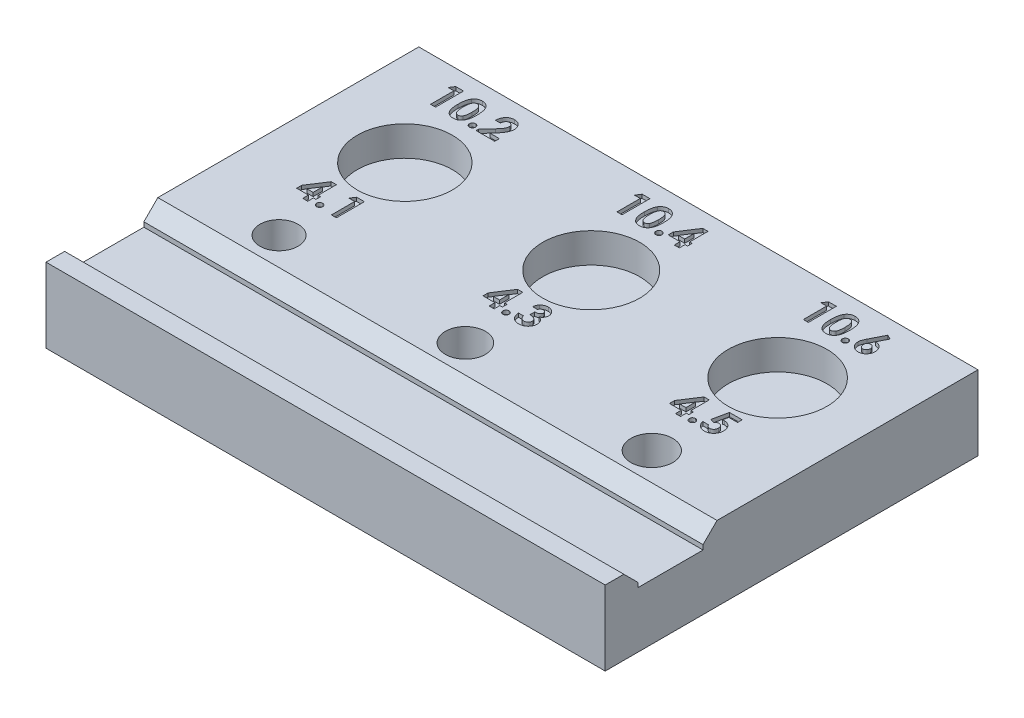
from build123d import *

# Parameters (mm, degrees)
CROQUIS1_W              = 60
CROQUIS1_H              = 40
SALIENTE_EXTRUIR1_DEPTH = 8
CROQUIS2_R              = 5.1
CORTAR_EXTRUIR1_DEPTH   = 3.2
CROQUIS3_R              = 5.2
CORTAR_EXTRUIR2_DEPTH   = 3.2
CROQUIS4_R              = 5.3
CORTAR_EXTRUIR3_DEPTH   = 3.2
CROQUIS5_R              = 2.05
CORTAR_EXTRUIR4_DEPTH   = 4.3
CROQUIS6_R              = 2.15
CORTAR_EXTRUIR5_DEPTH   = 4.3
CROQUIS7_R              = 2.25
CORTAR_EXTRUIR6_DEPTH   = 4.3
CROQUIS8_W              = 60
CROQUIS8_H              = 7
CORTAR_EXTRUIR7_DEPTH   = 2
CHAFL_N1_SIZE           = 1.5
CORTAR_EXTRUIR8_DEPTH   = 0.4


with BuildPart() as part:
    # Croquis1 → Saliente-Extruir1 (new body)
    with BuildSketch(Plane(origin=(0, 0, 0), x_dir=(1, 0, 0), z_dir=(0, 1, 0))):
        Rectangle(CROQUIS1_W, CROQUIS1_H)
    extrude(amount=-SALIENTE_EXTRUIR1_DEPTH)

    # Croquis2 → Cortar-Extruir1 (cut)
    with BuildSketch(Plane(origin=(0, 0, 0), x_dir=(1, 0, 0), z_dir=(0, 1, 0))):
        with Locations(Location((-20, 8.5, 0), (0, 0, 270))):
            Circle(CROQUIS2_R)
    extrude(amount=-CORTAR_EXTRUIR1_DEPTH, mode=Mode.SUBTRACT)

    # Croquis3 → Cortar-Extruir2 (cut)
    with BuildSketch(Plane(origin=(0, 0, 0), x_dir=(1, 0, 0), z_dir=(0, 1, 0))):
        with Locations(Location((0, 8.5, 0), (0, 0, 270))):
            Circle(CROQUIS3_R)
    extrude(amount=-CORTAR_EXTRUIR2_DEPTH, mode=Mode.SUBTRACT)

    # Croquis4 → Cortar-Extruir3 (cut)
    with BuildSketch(Plane(origin=(0, 0, 0), x_dir=(1, 0, 0), z_dir=(0, 1, 0))):
        with Locations(Location((20, 8.5, 0), (0, 0, 270))):
            Circle(CROQUIS4_R)
    extrude(amount=-CORTAR_EXTRUIR3_DEPTH, mode=Mode.SUBTRACT)

    # Croquis5 → Cortar-Extruir4 (cut)
    with BuildSketch(Plane(origin=(0, 0, 0), x_dir=(1, 0, 0), z_dir=(0, 1, 0))):
        with Locations(Location((-20, -5, 0), (0, 0, 270))):
            Circle(CROQUIS5_R)
    extrude(amount=-CORTAR_EXTRUIR4_DEPTH, mode=Mode.SUBTRACT)

    # Croquis6 → Cortar-Extruir5 (cut)
    with BuildSketch(Plane(origin=(0, 0, 0), x_dir=(1, 0, 0), z_dir=(0, 1, 0))):
        with Locations(Location((0, -5, 0), (0, 0, 270))):
            Circle(CROQUIS6_R)
    extrude(amount=-CORTAR_EXTRUIR5_DEPTH, mode=Mode.SUBTRACT)

    # Croquis7 → Cortar-Extruir6 (cut)
    with BuildSketch(Plane(origin=(0, 0, 0), x_dir=(1, 0, 0), z_dir=(0, 1, 0))):
        with Locations(Location((20, -5, 0), (0, 0, 270))):
            Circle(CROQUIS7_R)
    extrude(amount=-CORTAR_EXTRUIR6_DEPTH, mode=Mode.SUBTRACT)

    # Croquis8 → Cortar-Extruir7 (cut)
    with BuildSketch(Plane(origin=(0, 0, 0), x_dir=(1, 0, 0), z_dir=(0, 1, 0))):
        with Locations((0, -13)):
            Rectangle(CROQUIS8_W, CROQUIS8_H)
    extrude(amount=-CORTAR_EXTRUIR7_DEPTH, mode=Mode.SUBTRACT)

    # Chaflán1
    chafl_n1_edges = [part.edges().sort_by_distance(p)[0] for p in [
        (0, 0, 16.5),
        (0, 0, 9.5),
    ]]
    chamfer(chafl_n1_edges, length=CHAFL_N1_SIZE)

    # Croquis9 → Cortar-Extruir8 (cut)
    # profile 1 of 21: a face of its own
    with BuildSketch(Plane(origin=(0, 0, 0), x_dir=(1, 0, 0), z_dir=(0, 1, 0))):
        Polygon((-24.332331731, 18.3), (-23.5, 18.3), (-23.5, 15.3), (-24.038461538, 15.3), (-24.038461538, 17.8), (-24.653846154, 17.8), align=None)
    # profile 2 of 21: a face of its own
    with BuildSketch(Plane(origin=(0, 0, 0), x_dir=(1, 0, 0), z_dir=(0, 1, 0))):
        with BuildLine():
            add(Edge.make_bspline(
                [(-21.566706731, 18.376923077), (-21.540642957, 18.376536153), (-21.489394615, 18.375775357), (-21.413915454, 18.367535315), (-21.341208153, 18.355086911), (-21.270988273, 18.337725728), (-21.203761262, 18.314748821), (-21.13903783, 18.287245856), (-21.077588371, 18.253774248), (-21.01862921, 18.215966347), (-20.962183058, 18.173162443), (-20.909606557, 18.124363783), (-20.85993955, 18.070693226), (-20.814257145, 18.011339368), (-20.77154769, 17.946842097), (-20.731951521, 17.877191185), (-20.695771758, 17.802045738), (-20.662602911, 17.721270149), (-20.632943224, 17.633653628), (-20.607960906, 17.538191174), (-20.586534388, 17.434860988), (-20.568448895, 17.323405865), (-20.554779185, 17.203677655), (-20.545565525, 17.075755898), (-20.539242676, 16.939887209), (-20.538726649, 16.846682405), (-20.538461538, 16.798798077)],
                knots=[0, 0, 0, 0, 0.879237366, 1.728815576, 2.559023295, 3.367336655, 4.166867292, 4.954216142, 5.737608147, 6.525189134, 7.316157332, 8.124696809, 8.942788509, 9.781158001, 10.649253743, 11.551476218, 12.482711956, 13.461909668, 14.496590415, 15.601789533, 16.789733467, 18.056700938, 19.410929216, 20.8549011, 22.384193279, 24, 24, 24, 24], degree=3))
            add(Edge.make_bspline(
                [(-20.538461538, 16.798798077), (-20.538748052, 16.750314662), (-20.539304742, 16.656112256), (-20.545302683, 16.519000843), (-20.555631421, 16.390150298), (-20.568943844, 16.26957395), (-20.587178222, 16.157335474), (-20.608533214, 16.053144248), (-20.63390987, 15.957038038), (-20.664546539, 15.869233393), (-20.697514614, 15.788315944), (-20.733793344, 15.713317013), (-20.772750397, 15.644033459), (-20.813492214, 15.579420047), (-20.858252412, 15.521381547), (-20.904852387, 15.467944346), (-20.955321183, 15.421143937), (-21.00753387, 15.378568436), (-21.06340321, 15.341774659), (-21.122353036, 15.309595428), (-21.185434323, 15.283494249), (-21.251497205, 15.260792839), (-21.321667737, 15.244495675), (-21.394830919, 15.231564412), (-21.47181275, 15.224417802), (-21.52422508, 15.223531218), (-21.551081731, 15.223076923)],
                knots=[0, 0, 0, 0, 1.643780988, 3.193836972, 4.651895693, 6.025988579, 7.305620092, 8.505800249, 9.631074763, 10.672816429, 11.65661981, 12.592235626, 13.49536222, 14.350718032, 15.179365177, 15.97804903, 16.751647189, 17.51006938, 18.259804725, 19.016521909, 19.783502495, 20.571750527, 21.382245291, 22.22305063, 23.089471752, 24, 24, 24, 24], degree=3))
            add(Edge.make_bspline(
                [(-21.551081731, 15.223076923), (-21.577937656, 15.223539981), (-21.630548019, 15.224447106), (-21.707738016, 15.231511274), (-21.781288927, 15.24454806), (-21.85201462, 15.260917956), (-21.919422858, 15.28344402), (-21.983836859, 15.310326127), (-22.044761336, 15.342304576), (-22.10236498, 15.379184079), (-22.156451115, 15.421474718), (-22.207860239, 15.468724147), (-22.256478633, 15.520812601), (-22.301566689, 15.578323513), (-22.343862821, 15.640489233), (-22.382925945, 15.708019664), (-22.418732587, 15.780816481), (-22.452402784, 15.858981158), (-22.481657924, 15.944196489), (-22.50769364, 16.037223436), (-22.529021413, 16.138837457), (-22.546174636, 16.249005906), (-22.559869759, 16.367495387), (-22.570057357, 16.494363091), (-22.576088614, 16.62966811), (-22.576639466, 16.72266999), (-22.576923077, 16.770552885)],
                knots=[0, 0, 0, 0, 0.917216111, 1.796812873, 2.643793957, 3.46689424, 4.273913431, 5.068098542, 5.848489301, 6.620921603, 7.401012384, 8.190319798, 9.003608147, 9.831726257, 10.68377682, 11.569763213, 12.493818149, 13.453288342, 14.474581811, 15.568529029, 16.750744269, 18.018426408, 19.375425659, 20.823733699, 22.36466933, 24, 24, 24, 24], degree=3))
            add(Edge.make_bspline(
                [(-22.576923077, 16.770552885), (-22.576409342, 16.837082398), (-22.575418083, 16.96545195), (-22.562856122, 17.15090863), (-22.544418351, 17.322331205), (-22.517337632, 17.479432927), (-22.483852697, 17.622795656), (-22.440973495, 17.751474991), (-22.392158643, 17.867251502), (-22.350562117, 17.935838203), (-22.330528846, 17.968870192)],
                knots=[0, 0, 0, 0, 1.288568992, 2.486310467, 3.599230591, 4.627010532, 5.572937695, 6.447898582, 7.252493626, 8, 8, 8, 8], degree=3))
            add(Edge.make_bspline(
                [(-22.330528846, 17.968870192), (-22.307235113, 18.001320808), (-22.261691275, 18.064768156), (-22.182056601, 18.148062663), (-22.096499512, 18.219300205), (-22.003262714, 18.276868612), (-21.903820786, 18.322267062), (-21.797319969, 18.354331475), (-21.684153552, 18.373013697), (-21.606440285, 18.375600491), (-21.566706731, 18.376923077)],
                knots=[0, 0, 0, 0, 1.058512271, 2.069600068, 3.047294572, 4.004278952, 4.967380941, 5.939006123, 6.946246673, 8, 8, 8, 8], degree=3))
        make_face()
        with BuildLine():
            add(Edge.make_bspline(
                [(-21.553485577, 17.838461538), (-21.577047444, 17.837344753), (-21.623241211, 17.83515526), (-21.690270568, 17.816569556), (-21.753475067, 17.787862934), (-21.801553041, 17.753319002), (-21.837538927, 17.720204501), (-21.862682523, 17.690236955), (-21.886929558, 17.656795333), (-21.908345761, 17.618370587), (-21.928568247, 17.576343363), (-21.948331711, 17.530522884), (-21.964532562, 17.479783698), (-21.980449469, 17.424989901), (-21.994394165, 17.364626591), (-22.006076762, 17.298200362), (-22.016514137, 17.22527924), (-22.023794329, 17.145815462), (-22.030581654, 17.059892165), (-22.03544713, 16.967317946), (-22.037481263, 16.86811778), (-22.038127852, 16.799800098), (-22.038461538, 16.764543269)],
                knots=[0, 0, 0, 0, 1.076674018, 2.110852608, 3.161083442, 4.239746716, 4.804137807, 5.395870207, 6.026861976, 6.692161227, 7.405688833, 8.16177676, 8.973626916, 9.841385931, 10.773283133, 11.807421078, 12.927755683, 14.143907515, 15.458935494, 16.872852025, 18.386167141, 20, 20, 20, 20], degree=3))
            add(Edge.make_bspline(
                [(-22.038461538, 16.764543269), (-22.037912331, 16.718866343), (-22.036859185, 16.631277451), (-22.0313433, 16.505321574), (-22.020287167, 16.390691584), (-22.006535569, 16.286610591), (-21.987220888, 16.193753587), (-21.964998097, 16.11124206), (-21.937554927, 16.040127831), (-21.905839055, 15.979382429), (-21.870712299, 15.927706441), (-21.832580659, 15.883781619), (-21.792742382, 15.845744795), (-21.749953986, 15.814847952), (-21.704317551, 15.791170035), (-21.656214057, 15.774138803), (-21.605612935, 15.763713276), (-21.570961809, 15.76226759), (-21.553485577, 15.761538462)],
                knots=[0, 0, 0, 0, 1.771748488, 3.397459088, 4.888034009, 6.237357457, 7.467047327, 8.564189669, 9.548206622, 10.417051504, 11.216568818, 11.965764335, 12.669334354, 13.348544111, 14.005342236, 14.656555988, 15.322436492, 16, 16, 16, 16], degree=3))
            add(Edge.make_bspline(
                [(-21.553485577, 15.761538462), (-21.536609074, 15.762037386), (-21.50356698, 15.763014217), (-21.455384207, 15.773041259), (-21.409819152, 15.789343052), (-21.367009393, 15.812403082), (-21.326801802, 15.841727438), (-21.289392892, 15.877444985), (-21.255064791, 15.919911742), (-21.235065084, 15.951428357), (-21.224759615, 15.967668269)],
                knots=[0, 0, 0, 0, 0.992283464, 1.942767638, 2.88273346, 3.832339453, 4.79467288, 5.803907806, 6.868395428, 8, 8, 8, 8], degree=3))
            add(Edge.make_bspline(
                [(-21.224759615, 15.967668269), (-21.212626661, 15.989859591), (-21.18718484, 16.036392992), (-21.157743521, 16.114916372), (-21.13296146, 16.203477767), (-21.111631902, 16.302352787), (-21.097043786, 16.411931409), (-21.084480518, 16.531518784), (-21.078420941, 16.661717107), (-21.077435318, 16.751918975), (-21.076923077, 16.798798077)],
                knots=[0, 0, 0, 0, 0.710965849, 1.490837728, 2.352621235, 3.297892224, 4.334225155, 5.461620853, 6.680770821, 8, 8, 8, 8], degree=3))
            add(Edge.make_bspline(
                [(-21.076923077, 16.798798077), (-21.077120945, 16.846084113), (-21.077501806, 16.937101659), (-21.084489515, 17.067768054), (-21.094220434, 17.18711012), (-21.108453958, 17.294861414), (-21.126767974, 17.391283509), (-21.149340069, 17.476370104), (-21.175950889, 17.550288885), (-21.20750815, 17.612966147), (-21.242459778, 17.666233222), (-21.279561997, 17.71193224), (-21.318971692, 17.750948909), (-21.360622957, 17.783430055), (-21.405479824, 17.808248087), (-21.452685469, 17.82577167), (-21.502336667, 17.836372851), (-21.536205813, 17.837755912), (-21.553485577, 17.838461538)],
                knots=[0, 0, 0, 0, 1.793836731, 3.452829483, 4.963243077, 6.335886805, 7.574563692, 8.684454726, 9.672768357, 10.54971625, 11.340229787, 12.085688095, 12.778991901, 13.440269426, 14.083255152, 14.715733572, 15.344777694, 16, 16, 16, 16], degree=3))
        make_face(mode=Mode.SUBTRACT)
    # profile 3 of 21: a face of its own
    with BuildSketch(Plane(origin=(0, 0, 0), x_dir=(1, 0, 0), z_dir=(0, 1, 0))):
        with BuildLine():
            add(Edge.make_bspline(
                [(-19.826923077, 15.915384615), (-19.805186023, 15.914192825), (-19.762389518, 15.911846395), (-19.700554404, 15.894335237), (-19.644747857, 15.862873947), (-19.594849348, 15.821838146), (-19.552656425, 15.772466599), (-19.522160334, 15.716164386), (-19.503169653, 15.654567531), (-19.501073069, 15.611636383), (-19.5, 15.589663462)],
                knots=[0, 0, 0, 0, 1.016957001, 2.002212695, 2.9757545, 3.99499976, 5.013036768, 5.994806404, 6.97370641, 8, 8, 8, 8], degree=3))
            add(Edge.make_bspline(
                [(-19.5, 15.589663462), (-19.501066039, 15.567687011), (-19.503148889, 15.524748968), (-19.522291748, 15.463032087), (-19.552610854, 15.406267121), (-19.594852733, 15.356366526), (-19.64454121, 15.314557367), (-19.700682713, 15.283386196), (-19.762271723, 15.264881674), (-19.80516529, 15.262663587), (-19.826923077, 15.261538462)],
                knots=[0, 0, 0, 0, 1.023218912, 1.999186227, 2.986238111, 4.008388923, 5.030539734, 6.0011649, 6.986089706, 8, 8, 8, 8], degree=3))
            add(Edge.make_bspline(
                [(-19.826923077, 15.261538462), (-19.848686019, 15.262654438), (-19.891589749, 15.264854488), (-19.953274496, 15.283542171), (-20.009830479, 15.314349256), (-20.059531441, 15.35641724), (-20.101962038, 15.406090419), (-20.131419143, 15.463211191), (-20.150740312, 15.5247257), (-20.152794688, 15.567679134), (-20.153846154, 15.589663462)],
                knots=[0, 0, 0, 0, 1.013427518, 1.99788335, 2.976245624, 3.997909735, 5.019573847, 6.001765691, 6.977268297, 8, 8, 8, 8], degree=3))
            add(Edge.make_bspline(
                [(-20.153846154, 15.589663462), (-20.152787751, 15.611644398), (-20.150719822, 15.654591204), (-20.131550183, 15.71598322), (-20.101914827, 15.772644262), (-20.059534979, 15.821787326), (-20.009622767, 15.863080433), (-19.953403525, 15.894181399), (-19.891472014, 15.911873782), (-19.848665311, 15.91420205), (-19.826923077, 15.915384615)],
                knots=[0, 0, 0, 0, 1.025808215, 2.00424526, 2.981110158, 3.998665696, 5.017428914, 5.998734231, 6.983523959, 8, 8, 8, 8], degree=3))
        make_face()
    # profile 4 of 21: a face of its own
    with BuildSketch(Plane(origin=(0, 0, 0), x_dir=(1, 0, 0), z_dir=(0, 1, 0))):
        with BuildLine():
            Line((-18.538461538, 17.3), (-19.076923077, 17.3))
            add(Edge.make_bspline(
                [(-19.076923077, 17.3), (-19.074597544, 17.340731767), (-19.070053593, 17.420319193), (-19.051978902, 17.535922479), (-19.027759437, 17.645154871), (-18.995435346, 17.747634264), (-18.954818011, 17.843323419), (-18.906952619, 17.932548547), (-18.85061632, 18.014839874), (-18.787008135, 18.089800546), (-18.717207957, 18.157048456), (-18.642664904, 18.216674678), (-18.562238741, 18.265876736), (-18.47739892, 18.306365474), (-18.388159887, 18.338714095), (-18.293677301, 18.360341766), (-18.194769242, 18.374988236), (-18.127058667, 18.376269861), (-18.092548077, 18.376923077)],
                knots=[0, 0, 0, 0, 1.199038563, 2.342849363, 3.436047546, 4.486744587, 5.497670872, 6.488682221, 7.459191391, 8.424610317, 9.374430501, 10.305433194, 11.225809216, 12.140057399, 13.06607119, 14.010487599, 14.985989317, 16, 16, 16, 16], degree=3))
            add(Edge.make_bspline(
                [(-18.092548077, 18.376923077), (-18.050186817, 18.375601294), (-17.967487711, 18.373020864), (-17.847319351, 18.351008939), (-17.735095241, 18.314190592), (-17.630896958, 18.262745652), (-17.53561156, 18.197390248), (-17.449254848, 18.119464625), (-17.374438388, 18.027333863), (-17.31068782, 17.924831372), (-17.257718717, 17.81629566), (-17.220600176, 17.704065233), (-17.196202558, 17.591118232), (-17.193600401, 17.515065438), (-17.192307692, 17.477283654)],
                knots=[0, 0, 0, 0, 1.075374347, 2.099382735, 3.09057751, 4.06680945, 5.040638231, 6.016817125, 7.011024321, 8.044445721, 9.0776792, 10.070479129, 11.0414456, 12, 12, 12, 12], degree=3))
            add(Edge.make_bspline(
                [(-17.192307692, 17.477283654), (-17.192811005, 17.454430561), (-17.193824049, 17.408432929), (-17.200867878, 17.338827224), (-17.211435014, 17.267925674), (-17.227367679, 17.195789073), (-17.247237019, 17.122397199), (-17.2713414, 17.047530415), (-17.300239948, 16.971613188), (-17.333450403, 16.893791084), (-17.373070561, 16.813811444), (-17.419202727, 16.730475342), (-17.473071354, 16.643856704), (-17.534025777, 16.553466453), (-17.602362037, 16.459447149), (-17.678413729, 16.362082006), (-17.761304916, 16.261027941), (-17.820135123, 16.19347897), (-17.850360577, 16.158774038)],
                knots=[0, 0, 0, 0, 0.728284026, 1.46585585, 2.227944881, 3.01186502, 3.81876927, 4.650621989, 5.517437689, 6.406905708, 7.346299482, 8.360816762, 9.441613733, 10.596154504, 11.834900912, 13.145207542, 14.533280747, 16, 16, 16, 16], degree=3))
            Line((-17.850360577, 16.158774038), (-18.163461538, 15.8))
            Line((-18.163461538, 15.8), (-17.153846154, 15.8))
            Line((-17.153846154, 15.8), (-17.153846154, 15.3))
            Line((-17.153846154, 15.3), (-19.153846154, 15.3))
            Line((-19.153846154, 15.3), (-19.153846154, 15.572836538))
            Line((-19.153846154, 15.572836538), (-18.265625, 16.518149038))
            add(Edge.make_bspline(
                [(-18.265625, 16.518149038), (-18.239908715, 16.545724098), (-18.190103897, 16.59912881), (-18.119236775, 16.677559311), (-18.055108288, 16.751987985), (-17.999048195, 16.823207346), (-17.948114534, 16.888907328), (-17.904578432, 16.951068211), (-17.868041568, 17.009128039), (-17.82837562, 17.07913805), (-17.790706009, 17.162637447), (-17.756141861, 17.258832176), (-17.73507262, 17.350772183), (-17.732164399, 17.410682268), (-17.730769231, 17.439423077)],
                knots=[0, 0, 0, 0, 1.246127091, 2.413378631, 3.493388633, 4.492180848, 5.408488754, 6.240484944, 6.999099869, 7.674939598, 8.898438119, 10.020720584, 11.050475521, 12, 12, 12, 12], degree=3))
            add(Edge.make_bspline(
                [(-17.730769231, 17.439423077), (-17.731812364, 17.467227592), (-17.733833603, 17.521103299), (-17.756045374, 17.597741205), (-17.790456621, 17.667129005), (-17.838946927, 17.727193315), (-17.897683875, 17.77655214), (-17.965559936, 17.813263848), (-18.04202172, 17.834446336), (-18.095622887, 17.837097626), (-18.123197115, 17.838461538)],
                knots=[0, 0, 0, 0, 1.062038974, 2.057870785, 3.028805853, 4.01125022, 4.991535629, 5.949134679, 6.94496649, 8, 8, 8, 8], degree=3))
            add(Edge.make_bspline(
                [(-18.123197115, 17.838461538), (-18.137442313, 17.837957693), (-18.165486272, 17.836965792), (-18.206708699, 17.830362976), (-18.2459348, 17.818726203), (-18.283601184, 17.803134564), (-18.319305864, 17.782467735), (-18.352958782, 17.756992576), (-18.384914514, 17.727356468), (-18.415026499, 17.693652079), (-18.442432336, 17.656037972), (-18.466774101, 17.614857673), (-18.486900688, 17.570136746), (-18.504620866, 17.522465573), (-18.518287516, 17.471332129), (-18.528238532, 17.417042441), (-18.535803625, 17.359684831), (-18.53755945, 17.320256868), (-18.538461538, 17.3)],
                knots=[0, 0, 0, 0, 0.903469896, 1.778625579, 2.63899355, 3.493148037, 4.358286772, 5.247621495, 6.164656832, 7.118446693, 8.109501108, 9.111810964, 10.146451449, 11.215617525, 12.33435995, 13.498009769, 14.714554818, 16, 16, 16, 16], degree=3))
        make_face()
    # profile 5 of 21: a face of its own
    with BuildSketch(Plane(origin=(0, 0, 0), x_dir=(1, 0, 0), z_dir=(0, 1, 0))):
        Polygon((-4.332331731, 18.3), (-3.5, 18.3), (-3.5, 15.3), (-4.038461538, 15.3), (-4.038461538, 17.8), (-4.653846154, 17.8), align=None)
    # profile 6 of 21: a face of its own
    with BuildSketch(Plane(origin=(0, 0, 0), x_dir=(1, 0, 0), z_dir=(0, 1, 0))):
        with BuildLine():
            add(Edge.make_bspline(
                [(-1.566706731, 18.376923077), (-1.540642957, 18.376536153), (-1.489394615, 18.375775357), (-1.413915454, 18.367535315), (-1.341208153, 18.355086911), (-1.270988273, 18.337725728), (-1.203761262, 18.314748821), (-1.13903783, 18.287245856), (-1.077588371, 18.253774248), (-1.01862921, 18.215966347), (-0.962183058, 18.173162443), (-0.909606557, 18.124363783), (-0.85993955, 18.070693226), (-0.814257145, 18.011339368), (-0.77154769, 17.946842097), (-0.731951521, 17.877191185), (-0.695771758, 17.802045738), (-0.662602911, 17.721270149), (-0.632943224, 17.633653628), (-0.607960906, 17.538191174), (-0.586534388, 17.434860988), (-0.568448895, 17.323405865), (-0.554779185, 17.203677655), (-0.545565525, 17.075755898), (-0.539242676, 16.939887209), (-0.538726649, 16.846682405), (-0.538461538, 16.798798077)],
                knots=[0, 0, 0, 0, 0.879237366, 1.728815576, 2.559023295, 3.367336655, 4.166867292, 4.954216142, 5.737608147, 6.525189134, 7.316157332, 8.124696809, 8.942788509, 9.781158001, 10.649253743, 11.551476218, 12.482711956, 13.461909668, 14.496590415, 15.601789533, 16.789733467, 18.056700938, 19.410929216, 20.8549011, 22.384193279, 24, 24, 24, 24], degree=3))
            add(Edge.make_bspline(
                [(-0.538461538, 16.798798077), (-0.538748052, 16.750314662), (-0.539304742, 16.656112256), (-0.545302683, 16.519000843), (-0.555631421, 16.390150298), (-0.568943844, 16.26957395), (-0.587178222, 16.157335474), (-0.608533214, 16.053144248), (-0.63390987, 15.957038038), (-0.664546539, 15.869233393), (-0.697514614, 15.788315944), (-0.733793344, 15.713317013), (-0.772750397, 15.644033459), (-0.813492214, 15.579420047), (-0.858252412, 15.521381547), (-0.904852387, 15.467944346), (-0.955321183, 15.421143937), (-1.00753387, 15.378568436), (-1.06340321, 15.341774659), (-1.122353036, 15.309595428), (-1.185434323, 15.283494249), (-1.251497205, 15.260792839), (-1.321667737, 15.244495675), (-1.394830919, 15.231564412), (-1.47181275, 15.224417802), (-1.52422508, 15.223531218), (-1.551081731, 15.223076923)],
                knots=[0, 0, 0, 0, 1.643780988, 3.193836972, 4.651895693, 6.025988579, 7.305620092, 8.505800249, 9.631074763, 10.672816429, 11.65661981, 12.592235626, 13.49536222, 14.350718032, 15.179365177, 15.97804903, 16.751647189, 17.51006938, 18.259804725, 19.016521909, 19.783502495, 20.571750527, 21.382245291, 22.22305063, 23.089471752, 24, 24, 24, 24], degree=3))
            add(Edge.make_bspline(
                [(-1.551081731, 15.223076923), (-1.577937656, 15.223539981), (-1.630548019, 15.224447106), (-1.707738016, 15.231511274), (-1.781288927, 15.24454806), (-1.85201462, 15.260917956), (-1.919422858, 15.28344402), (-1.983836859, 15.310326127), (-2.044761336, 15.342304576), (-2.10236498, 15.379184079), (-2.156451115, 15.421474718), (-2.207860239, 15.468724147), (-2.256478633, 15.520812601), (-2.301566689, 15.578323513), (-2.343862821, 15.640489233), (-2.382925945, 15.708019664), (-2.418732587, 15.780816481), (-2.452402784, 15.858981158), (-2.481657924, 15.944196489), (-2.50769364, 16.037223436), (-2.529021413, 16.138837457), (-2.546174636, 16.249005906), (-2.559869759, 16.367495387), (-2.570057357, 16.494363091), (-2.576088614, 16.62966811), (-2.576639466, 16.72266999), (-2.576923077, 16.770552885)],
                knots=[0, 0, 0, 0, 0.917216111, 1.796812873, 2.643793957, 3.46689424, 4.273913431, 5.068098542, 5.848489301, 6.620921603, 7.401012384, 8.190319798, 9.003608147, 9.831726257, 10.68377682, 11.569763213, 12.493818149, 13.453288342, 14.474581811, 15.568529029, 16.750744269, 18.018426408, 19.375425659, 20.823733699, 22.36466933, 24, 24, 24, 24], degree=3))
            add(Edge.make_bspline(
                [(-2.576923077, 16.770552885), (-2.576409342, 16.837082398), (-2.575418083, 16.96545195), (-2.562856122, 17.15090863), (-2.544418351, 17.322331205), (-2.517337632, 17.479432927), (-2.483852697, 17.622795656), (-2.440973495, 17.751474991), (-2.392158643, 17.867251502), (-2.350562117, 17.935838203), (-2.330528846, 17.968870192)],
                knots=[0, 0, 0, 0, 1.288568992, 2.486310467, 3.599230591, 4.627010532, 5.572937695, 6.447898582, 7.252493626, 8, 8, 8, 8], degree=3))
            add(Edge.make_bspline(
                [(-2.330528846, 17.968870192), (-2.307235113, 18.001320808), (-2.261691275, 18.064768156), (-2.182056601, 18.148062663), (-2.096499512, 18.219300205), (-2.003262714, 18.276868612), (-1.903820786, 18.322267062), (-1.797319969, 18.354331475), (-1.684153552, 18.373013697), (-1.606440285, 18.375600491), (-1.566706731, 18.376923077)],
                knots=[0, 0, 0, 0, 1.058512271, 2.069600068, 3.047294572, 4.004278952, 4.967380941, 5.939006123, 6.946246673, 8, 8, 8, 8], degree=3))
        make_face()
        with BuildLine():
            add(Edge.make_bspline(
                [(-1.553485577, 17.838461538), (-1.577047444, 17.837344753), (-1.623241211, 17.83515526), (-1.690270568, 17.816569556), (-1.753475067, 17.787862934), (-1.801553041, 17.753319002), (-1.837538927, 17.720204501), (-1.862682523, 17.690236955), (-1.886929558, 17.656795333), (-1.908345761, 17.618370587), (-1.928568247, 17.576343363), (-1.948331711, 17.530522884), (-1.964532562, 17.479783698), (-1.980449469, 17.424989901), (-1.994394165, 17.364626591), (-2.006076762, 17.298200362), (-2.016514137, 17.22527924), (-2.023794329, 17.145815462), (-2.030581654, 17.059892165), (-2.03544713, 16.967317946), (-2.037481263, 16.86811778), (-2.038127852, 16.799800098), (-2.038461538, 16.764543269)],
                knots=[0, 0, 0, 0, 1.076674018, 2.110852608, 3.161083442, 4.239746716, 4.804137807, 5.395870207, 6.026861976, 6.692161227, 7.405688833, 8.16177676, 8.973626916, 9.841385931, 10.773283133, 11.807421078, 12.927755683, 14.143907515, 15.458935494, 16.872852025, 18.386167141, 20, 20, 20, 20], degree=3))
            add(Edge.make_bspline(
                [(-2.038461538, 16.764543269), (-2.037912331, 16.718866343), (-2.036859185, 16.631277451), (-2.0313433, 16.505321574), (-2.020287167, 16.390691584), (-2.006535569, 16.286610591), (-1.987220888, 16.193753587), (-1.964998097, 16.11124206), (-1.937554927, 16.040127831), (-1.905839055, 15.979382429), (-1.870712299, 15.927706441), (-1.832580659, 15.883781619), (-1.792742382, 15.845744795), (-1.749953986, 15.814847952), (-1.704317551, 15.791170035), (-1.656214057, 15.774138803), (-1.605612935, 15.763713276), (-1.570961809, 15.76226759), (-1.553485577, 15.761538462)],
                knots=[0, 0, 0, 0, 1.771748488, 3.397459088, 4.888034009, 6.237357457, 7.467047327, 8.564189669, 9.548206622, 10.417051504, 11.216568818, 11.965764335, 12.669334354, 13.348544111, 14.005342236, 14.656555988, 15.322436492, 16, 16, 16, 16], degree=3))
            add(Edge.make_bspline(
                [(-1.553485577, 15.761538462), (-1.536609074, 15.762037386), (-1.50356698, 15.763014217), (-1.455384207, 15.773041259), (-1.409819152, 15.789343052), (-1.367009393, 15.812403082), (-1.326801802, 15.841727438), (-1.289392892, 15.877444985), (-1.255064791, 15.919911742), (-1.235065084, 15.951428357), (-1.224759615, 15.967668269)],
                knots=[0, 0, 0, 0, 0.992283464, 1.942767638, 2.88273346, 3.832339453, 4.79467288, 5.803907806, 6.868395428, 8, 8, 8, 8], degree=3))
            add(Edge.make_bspline(
                [(-1.224759615, 15.967668269), (-1.212626661, 15.989859591), (-1.18718484, 16.036392992), (-1.157743521, 16.114916372), (-1.13296146, 16.203477767), (-1.111631902, 16.302352787), (-1.097043786, 16.411931409), (-1.084480518, 16.531518784), (-1.078420941, 16.661717107), (-1.077435318, 16.751918975), (-1.076923077, 16.798798077)],
                knots=[0, 0, 0, 0, 0.710965849, 1.490837728, 2.352621235, 3.297892224, 4.334225155, 5.461620853, 6.680770821, 8, 8, 8, 8], degree=3))
            add(Edge.make_bspline(
                [(-1.076923077, 16.798798077), (-1.077120945, 16.846084113), (-1.077501806, 16.937101659), (-1.084489515, 17.067768054), (-1.094220434, 17.18711012), (-1.108453958, 17.294861414), (-1.126767974, 17.391283509), (-1.149340069, 17.476370104), (-1.175950889, 17.550288885), (-1.20750815, 17.612966147), (-1.242459778, 17.666233222), (-1.279561997, 17.71193224), (-1.318971692, 17.750948909), (-1.360622957, 17.783430055), (-1.405479824, 17.808248087), (-1.452685469, 17.82577167), (-1.502336667, 17.836372851), (-1.536205813, 17.837755912), (-1.553485577, 17.838461538)],
                knots=[0, 0, 0, 0, 1.793836731, 3.452829483, 4.963243077, 6.335886805, 7.574563692, 8.684454726, 9.672768357, 10.54971625, 11.340229787, 12.085688095, 12.778991901, 13.440269426, 14.083255152, 14.715733572, 15.344777694, 16, 16, 16, 16], degree=3))
        make_face(mode=Mode.SUBTRACT)
    # profile 7 of 21: a face of its own
    with BuildSketch(Plane(origin=(0, 0, 0), x_dir=(1, 0, 0), z_dir=(0, 1, 0))):
        with BuildLine():
            add(Edge.make_bspline(
                [(0.173076923, 15.915384615), (0.194813977, 15.914192825), (0.237610482, 15.911846395), (0.299445596, 15.894335237), (0.355252143, 15.862873947), (0.405150652, 15.821838146), (0.447343575, 15.772466599), (0.477839666, 15.716164386), (0.496830347, 15.654567531), (0.498926931, 15.611636383), (0.5, 15.589663462)],
                knots=[0, 0, 0, 0, 1.016957001, 2.002212695, 2.9757545, 3.99499976, 5.013036768, 5.994806404, 6.97370641, 8, 8, 8, 8], degree=3))
            add(Edge.make_bspline(
                [(0.5, 15.589663462), (0.498933961, 15.567687011), (0.496851111, 15.524748968), (0.477708252, 15.463032087), (0.447389146, 15.406267121), (0.405147267, 15.356366526), (0.35545879, 15.314557367), (0.299317287, 15.283386196), (0.237728277, 15.264881674), (0.19483471, 15.262663587), (0.173076923, 15.261538462)],
                knots=[0, 0, 0, 0, 1.023218912, 1.999186227, 2.986238111, 4.008388923, 5.030539734, 6.0011649, 6.986089706, 8, 8, 8, 8], degree=3))
            add(Edge.make_bspline(
                [(0.173076923, 15.261538462), (0.151313981, 15.262654438), (0.108410251, 15.264854488), (0.046725504, 15.283542171), (-0.009830479, 15.314349256), (-0.059531441, 15.35641724), (-0.101962038, 15.406090419), (-0.131419143, 15.463211191), (-0.150740312, 15.5247257), (-0.152794688, 15.567679134), (-0.153846154, 15.589663462)],
                knots=[0, 0, 0, 0, 1.013427518, 1.99788335, 2.976245624, 3.997909735, 5.019573847, 6.001765691, 6.977268297, 8, 8, 8, 8], degree=3))
            add(Edge.make_bspline(
                [(-0.153846154, 15.589663462), (-0.152787751, 15.611644398), (-0.150719822, 15.654591204), (-0.131550183, 15.71598322), (-0.101914827, 15.772644262), (-0.059534979, 15.821787326), (-0.009622767, 15.863080433), (0.046596475, 15.894181399), (0.108527986, 15.911873782), (0.151334689, 15.91420205), (0.173076923, 15.915384615)],
                knots=[0, 0, 0, 0, 1.025808215, 2.00424526, 2.981110158, 3.998665696, 5.017428914, 5.998734231, 6.983523959, 8, 8, 8, 8], degree=3))
        make_face()
    # profile 8 of 21: a face of its own
    with BuildSketch(Plane(origin=(0, 0, 0), x_dir=(1, 0, 0), z_dir=(0, 1, 0))):
        Polygon((2.092548077, 18.376923077), (2.653846154, 18.376923077), (2.653846154, 16.415384615), (2.923076923, 16.415384615), (2.923076923, 15.915384615), (2.653846154, 15.915384615), (2.653846154, 15.3), (2.115384615, 15.3), (2.115384615, 15.915384615), (0.846153846, 15.915384615), (0.846153846, 16.460456731), align=None)
        Polygon((2.115384615, 16.415384615), (2.115384615, 17.436418269), (1.451322115, 16.415384615), align=None, mode=Mode.SUBTRACT)
    # profile 9 of 21: a face of its own
    with BuildSketch(Plane(origin=(0, 0, 0), x_dir=(1, 0, 0), z_dir=(0, 1, 0))):
        Polygon((15.667668269, 18.3), (16.5, 18.3), (16.5, 15.3), (15.961538462, 15.3), (15.961538462, 17.8), (15.346153846, 17.8), align=None)
    # profile 10 of 21: a face of its own
    with BuildSketch(Plane(origin=(0, 0, 0), x_dir=(1, 0, 0), z_dir=(0, 1, 0))):
        with BuildLine():
            add(Edge.make_bspline(
                [(18.433293269, 18.376923077), (18.459357043, 18.376536153), (18.510605385, 18.375775357), (18.586084546, 18.367535315), (18.658791847, 18.355086911), (18.729011727, 18.337725728), (18.796238738, 18.314748821), (18.86096217, 18.287245856), (18.922411629, 18.253774248), (18.98137079, 18.215966347), (19.037816942, 18.173162443), (19.090393443, 18.124363783), (19.14006045, 18.070693226), (19.185742855, 18.011339368), (19.22845231, 17.946842097), (19.268048479, 17.877191185), (19.304228242, 17.802045738), (19.337397089, 17.721270149), (19.367056776, 17.633653628), (19.392039094, 17.538191174), (19.413465612, 17.434860988), (19.431551105, 17.323405865), (19.445220815, 17.203677655), (19.454434475, 17.075755898), (19.460757324, 16.939887209), (19.461273351, 16.846682405), (19.461538462, 16.798798077)],
                knots=[0, 0, 0, 0, 0.879237366, 1.728815576, 2.559023295, 3.367336655, 4.166867292, 4.954216142, 5.737608147, 6.525189134, 7.316157332, 8.124696809, 8.942788509, 9.781158001, 10.649253743, 11.551476218, 12.482711956, 13.461909668, 14.496590415, 15.601789533, 16.789733467, 18.056700938, 19.410929216, 20.8549011, 22.384193279, 24, 24, 24, 24], degree=3))
            add(Edge.make_bspline(
                [(19.461538462, 16.798798077), (19.461251948, 16.750314662), (19.460695258, 16.656112256), (19.454697317, 16.519000843), (19.444368579, 16.390150298), (19.431056156, 16.26957395), (19.412821778, 16.157335474), (19.391466786, 16.053144248), (19.36609013, 15.957038038), (19.335453461, 15.869233393), (19.302485386, 15.788315944), (19.266206656, 15.713317013), (19.227249603, 15.644033459), (19.186507786, 15.579420047), (19.141747588, 15.521381547), (19.095147613, 15.467944346), (19.044678817, 15.421143937), (18.99246613, 15.378568436), (18.93659679, 15.341774659), (18.877646964, 15.309595428), (18.814565677, 15.283494249), (18.748502795, 15.260792839), (18.678332263, 15.244495675), (18.605169081, 15.231564412), (18.52818725, 15.224417802), (18.47577492, 15.223531218), (18.448918269, 15.223076923)],
                knots=[0, 0, 0, 0, 1.643780988, 3.193836972, 4.651895693, 6.025988579, 7.305620092, 8.505800249, 9.631074763, 10.672816429, 11.65661981, 12.592235626, 13.49536222, 14.350718032, 15.179365177, 15.97804903, 16.751647189, 17.51006938, 18.259804725, 19.016521909, 19.783502495, 20.571750527, 21.382245291, 22.22305063, 23.089471752, 24, 24, 24, 24], degree=3))
            add(Edge.make_bspline(
                [(18.448918269, 15.223076923), (18.422062344, 15.223539981), (18.369451981, 15.224447106), (18.292261984, 15.231511274), (18.218711073, 15.24454806), (18.14798538, 15.260917956), (18.080577142, 15.28344402), (18.016163141, 15.310326127), (17.955238664, 15.342304576), (17.89763502, 15.379184079), (17.843548885, 15.421474718), (17.792139761, 15.468724147), (17.743521367, 15.520812601), (17.698433311, 15.578323513), (17.656137179, 15.640489233), (17.617074055, 15.708019664), (17.581267413, 15.780816481), (17.547597216, 15.858981158), (17.518342076, 15.944196489), (17.49230636, 16.037223436), (17.470978587, 16.138837457), (17.453825364, 16.249005906), (17.440130241, 16.367495387), (17.429942643, 16.494363091), (17.423911386, 16.62966811), (17.423360534, 16.72266999), (17.423076923, 16.770552885)],
                knots=[0, 0, 0, 0, 0.917216111, 1.796812873, 2.643793957, 3.46689424, 4.273913431, 5.068098542, 5.848489301, 6.620921603, 7.401012384, 8.190319798, 9.003608147, 9.831726257, 10.68377682, 11.569763213, 12.493818149, 13.453288342, 14.474581811, 15.568529029, 16.750744269, 18.018426408, 19.375425659, 20.823733699, 22.36466933, 24, 24, 24, 24], degree=3))
            add(Edge.make_bspline(
                [(17.423076923, 16.770552885), (17.423590658, 16.837082398), (17.424581917, 16.96545195), (17.437143878, 17.15090863), (17.455581649, 17.322331205), (17.482662368, 17.479432927), (17.516147303, 17.622795656), (17.559026505, 17.751474991), (17.607841357, 17.867251502), (17.649437883, 17.935838203), (17.669471154, 17.968870192)],
                knots=[0, 0, 0, 0, 1.288568992, 2.486310467, 3.599230591, 4.627010532, 5.572937695, 6.447898582, 7.252493626, 8, 8, 8, 8], degree=3))
            add(Edge.make_bspline(
                [(17.669471154, 17.968870192), (17.692764887, 18.001320808), (17.738308725, 18.064768156), (17.817943399, 18.148062663), (17.903500488, 18.219300205), (17.996737286, 18.276868612), (18.096179214, 18.322267062), (18.202680031, 18.354331475), (18.315846448, 18.373013697), (18.393559715, 18.375600491), (18.433293269, 18.376923077)],
                knots=[0, 0, 0, 0, 1.058512271, 2.069600068, 3.047294572, 4.004278952, 4.967380941, 5.939006123, 6.946246673, 8, 8, 8, 8], degree=3))
        make_face()
        with BuildLine():
            add(Edge.make_bspline(
                [(18.446514423, 17.838461538), (18.422952556, 17.837344753), (18.376758789, 17.83515526), (18.309729432, 17.816569556), (18.246524933, 17.787862934), (18.198446959, 17.753319002), (18.162461073, 17.720204501), (18.137317477, 17.690236955), (18.113070442, 17.656795333), (18.091654239, 17.618370587), (18.071431753, 17.576343363), (18.051668289, 17.530522884), (18.035467438, 17.479783698), (18.019550531, 17.424989901), (18.005605835, 17.364626591), (17.993923238, 17.298200362), (17.983485863, 17.22527924), (17.976205671, 17.145815462), (17.969418346, 17.059892165), (17.96455287, 16.967317946), (17.962518737, 16.86811778), (17.961872148, 16.799800098), (17.961538462, 16.764543269)],
                knots=[0, 0, 0, 0, 1.076674018, 2.110852608, 3.161083442, 4.239746716, 4.804137807, 5.395870207, 6.026861976, 6.692161227, 7.405688833, 8.16177676, 8.973626916, 9.841385931, 10.773283133, 11.807421078, 12.927755683, 14.143907515, 15.458935494, 16.872852025, 18.386167141, 20, 20, 20, 20], degree=3))
            add(Edge.make_bspline(
                [(17.961538462, 16.764543269), (17.962087669, 16.718866343), (17.963140815, 16.631277451), (17.9686567, 16.505321574), (17.979712833, 16.390691584), (17.993464431, 16.286610591), (18.012779112, 16.193753587), (18.035001903, 16.11124206), (18.062445073, 16.040127831), (18.094160945, 15.979382429), (18.129287701, 15.927706441), (18.167419341, 15.883781619), (18.207257618, 15.845744795), (18.250046014, 15.814847952), (18.295682449, 15.791170035), (18.343785943, 15.774138803), (18.394387065, 15.763713276), (18.429038191, 15.76226759), (18.446514423, 15.761538462)],
                knots=[0, 0, 0, 0, 1.771748488, 3.397459088, 4.888034009, 6.237357457, 7.467047327, 8.564189669, 9.548206622, 10.417051504, 11.216568818, 11.965764335, 12.669334354, 13.348544111, 14.005342236, 14.656555988, 15.322436492, 16, 16, 16, 16], degree=3))
            add(Edge.make_bspline(
                [(18.446514423, 15.761538462), (18.463390926, 15.762037386), (18.49643302, 15.763014217), (18.544615793, 15.773041259), (18.590180848, 15.789343052), (18.632990607, 15.812403082), (18.673198198, 15.841727438), (18.710607108, 15.877444985), (18.744935209, 15.919911742), (18.764934916, 15.951428357), (18.775240385, 15.967668269)],
                knots=[0, 0, 0, 0, 0.992283464, 1.942767638, 2.88273346, 3.832339453, 4.79467288, 5.803907806, 6.868395428, 8, 8, 8, 8], degree=3))
            add(Edge.make_bspline(
                [(18.775240385, 15.967668269), (18.787373339, 15.989859591), (18.81281516, 16.036392992), (18.842256479, 16.114916372), (18.86703854, 16.203477767), (18.888368098, 16.302352787), (18.902956214, 16.411931409), (18.915519482, 16.531518784), (18.921579059, 16.661717107), (18.922564682, 16.751918975), (18.923076923, 16.798798077)],
                knots=[0, 0, 0, 0, 0.710965849, 1.490837728, 2.352621235, 3.297892224, 4.334225155, 5.461620853, 6.680770821, 8, 8, 8, 8], degree=3))
            add(Edge.make_bspline(
                [(18.923076923, 16.798798077), (18.922879055, 16.846084113), (18.922498194, 16.937101659), (18.915510485, 17.067768054), (18.905779566, 17.18711012), (18.891546042, 17.294861414), (18.873232026, 17.391283509), (18.850659931, 17.476370104), (18.824049111, 17.550288885), (18.79249185, 17.612966147), (18.757540222, 17.666233222), (18.720438003, 17.71193224), (18.681028308, 17.750948909), (18.639377043, 17.783430055), (18.594520176, 17.808248087), (18.547314531, 17.82577167), (18.497663333, 17.836372851), (18.463794187, 17.837755912), (18.446514423, 17.838461538)],
                knots=[0, 0, 0, 0, 1.793836731, 3.452829483, 4.963243077, 6.335886805, 7.574563692, 8.684454726, 9.672768357, 10.54971625, 11.340229787, 12.085688095, 12.778991901, 13.440269426, 14.083255152, 14.715733572, 15.344777694, 16, 16, 16, 16], degree=3))
        make_face(mode=Mode.SUBTRACT)
    # profile 11 of 21: a face of its own
    with BuildSketch(Plane(origin=(0, 0, 0), x_dir=(1, 0, 0), z_dir=(0, 1, 0))):
        with BuildLine():
            add(Edge.make_bspline(
                [(20.173076923, 15.915384615), (20.194813977, 15.914192825), (20.237610482, 15.911846395), (20.299445596, 15.894335237), (20.355252143, 15.862873947), (20.405150652, 15.821838146), (20.447343575, 15.772466599), (20.477839666, 15.716164386), (20.496830347, 15.654567531), (20.498926931, 15.611636383), (20.5, 15.589663462)],
                knots=[0, 0, 0, 0, 1.016957001, 2.002212695, 2.9757545, 3.99499976, 5.013036768, 5.994806404, 6.97370641, 8, 8, 8, 8], degree=3))
            add(Edge.make_bspline(
                [(20.5, 15.589663462), (20.498933961, 15.567687011), (20.496851111, 15.524748968), (20.477708252, 15.463032087), (20.447389146, 15.406267121), (20.405147267, 15.356366526), (20.35545879, 15.314557367), (20.299317287, 15.283386196), (20.237728277, 15.264881674), (20.19483471, 15.262663587), (20.173076923, 15.261538462)],
                knots=[0, 0, 0, 0, 1.023218912, 1.999186227, 2.986238111, 4.008388923, 5.030539734, 6.0011649, 6.986089706, 8, 8, 8, 8], degree=3))
            add(Edge.make_bspline(
                [(20.173076923, 15.261538462), (20.151313981, 15.262654438), (20.108410251, 15.264854488), (20.046725504, 15.283542171), (19.990169521, 15.314349256), (19.940468559, 15.35641724), (19.898037962, 15.406090419), (19.868580857, 15.463211191), (19.849259688, 15.5247257), (19.847205312, 15.567679134), (19.846153846, 15.589663462)],
                knots=[0, 0, 0, 0, 1.013427518, 1.99788335, 2.976245624, 3.997909735, 5.019573847, 6.001765691, 6.977268297, 8, 8, 8, 8], degree=3))
            add(Edge.make_bspline(
                [(19.846153846, 15.589663462), (19.847212249, 15.611644398), (19.849280178, 15.654591204), (19.868449817, 15.71598322), (19.898085173, 15.772644262), (19.940465021, 15.821787326), (19.990377233, 15.863080433), (20.046596475, 15.894181399), (20.108527986, 15.911873782), (20.151334689, 15.91420205), (20.173076923, 15.915384615)],
                knots=[0, 0, 0, 0, 1.025808215, 2.00424526, 2.981110158, 3.998665696, 5.017428914, 5.998734231, 6.983523959, 8, 8, 8, 8], degree=3))
        make_face()
    # profile 12 of 21: a face of its own
    with BuildSketch(Plane(origin=(0, 0, 0), x_dir=(1, 0, 0), z_dir=(0, 1, 0))):
        with BuildLine():
            Line((21.949519231, 18.376923077), (22.426081731, 18.135336538))
            Line((22.426081731, 18.135336538), (21.903245192, 17.107692308))
            add(Edge.make_bspline(
                [(21.903245192, 17.107692308), (21.934133884, 17.106892584), (21.994974229, 17.105317397), (22.084488451, 17.09258647), (22.170065714, 17.070577751), (22.252568888, 17.041405254), (22.330989452, 17.0022263), (22.406590412, 16.95562089), (22.477415933, 16.89878058), (22.545089984, 16.835804532), (22.60662565, 16.766036122), (22.660080256, 16.691067748), (22.706665001, 16.612723402), (22.742878106, 16.529250329), (22.772088804, 16.442032191), (22.793165607, 16.35072034), (22.805190513, 16.255050356), (22.806848347, 16.190057402), (22.807692308, 16.156971154)],
                knots=[0, 0, 0, 0, 1.013260694, 1.995783107, 2.958651975, 3.908806537, 4.861209129, 5.829647963, 6.817170299, 7.835534541, 8.860094905, 9.863329007, 10.853101798, 11.844815043, 12.84250023, 13.867713965, 14.914507806, 16, 16, 16, 16], degree=3))
            add(Edge.make_bspline(
                [(22.807692308, 16.156971154), (22.806901447, 16.125078018), (22.805338253, 16.062038965), (22.792416392, 15.969450628), (22.771533986, 15.880617533), (22.741688833, 15.795717092), (22.703753231, 15.714334307), (22.657360558, 15.636516936), (22.602126079, 15.562846482), (22.5394769, 15.493714395), (22.470990538, 15.430699986), (22.398802183, 15.374689112), (22.32230012, 15.328422005), (22.242930326, 15.289348349), (22.159231555, 15.260190936), (22.072456364, 15.238182141), (21.981946711, 15.225482111), (21.920511077, 15.223885068), (21.889423077, 15.223076923)],
                knots=[0, 0, 0, 0, 1.049934834, 2.075270938, 3.072134561, 4.05064612, 5.033440221, 6.024524368, 7.028587226, 8.060776465, 9.092543989, 10.090062252, 11.064205434, 12.031961459, 12.998029633, 13.977230324, 14.976426867, 16, 16, 16, 16], degree=3))
            add(Edge.make_bspline(
                [(21.889423077, 15.223076923), (21.856914476, 15.223740125), (21.792990711, 15.22504422), (21.699454244, 15.239646657), (21.609744723, 15.261628591), (21.524366328, 15.293015057), (21.442788117, 15.332979768), (21.365970527, 15.382432078), (21.293266476, 15.440826661), (21.225451095, 15.50684973), (21.16435449, 15.57916897), (21.109861425, 15.654255169), (21.063760221, 15.732226155), (21.026442372, 15.812998562), (20.99732612, 15.896315005), (20.977067148, 15.982333612), (20.963866557, 16.070826218), (20.962319089, 16.130882308), (20.961538462, 16.161177885)],
                knots=[0, 0, 0, 0, 1.063775006, 2.091769615, 3.092589432, 4.084662827, 5.064601646, 6.061867366, 7.070035304, 8.113879863, 9.156342271, 10.166834137, 11.149076039, 12.117706134, 13.076241869, 14.034148791, 15.008317125, 16, 16, 16, 16], degree=3))
            add(Edge.make_bspline(
                [(20.961538462, 16.161177885), (20.96195093, 16.184638265), (20.962778162, 16.231689615), (20.971091354, 16.302146456), (20.983730326, 16.372788238), (20.998380549, 16.432398012), (21.013465869, 16.482804313), (21.028649359, 16.525461804), (21.04746595, 16.572802292), (21.0689761, 16.624946665), (21.093856226, 16.681832193), (21.121976359, 16.743303821), (21.153406504, 16.809827059), (21.175820526, 16.855518223), (21.1875, 16.879326923)],
                knots=[0, 0, 0, 0, 1.110454016, 2.227089276, 3.35462975, 4.507227546, 5.131400587, 5.845402449, 6.650387134, 7.543487832, 8.516250726, 9.590168902, 10.744287919, 12, 12, 12, 12], degree=3))
            Line((21.1875, 16.879326923), (21.949519231, 18.376923077))
        make_face()
        with BuildLine():
            add(Edge.make_bspline(
                [(21.877403846, 16.607692308), (21.851566823, 16.606507218), (21.801007159, 16.604188153), (21.729118879, 16.579901776), (21.663573078, 16.541802495), (21.606757167, 16.488741878), (21.559235885, 16.425332358), (21.52431558, 16.35300533), (21.503309076, 16.272725979), (21.501126635, 16.216595995), (21.5, 16.187620192)],
                knots=[0, 0, 0, 0, 0.981744412, 1.921144944, 2.858899012, 3.85339082, 4.86292663, 5.863643845, 6.897155691, 8, 8, 8, 8], degree=3))
            add(Edge.make_bspline(
                [(21.5, 16.187620192), (21.501333971, 16.158634741), (21.503928633, 16.102256101), (21.525725009, 16.021212347), (21.561412441, 15.947242856), (21.611461787, 15.882993021), (21.670219001, 15.829660684), (21.735373781, 15.790218871), (21.805839324, 15.765988471), (21.854582061, 15.76303204), (21.879206731, 15.761538462)],
                knots=[0, 0, 0, 0, 1.098279937, 2.136227893, 3.159405121, 4.194678092, 5.206500211, 6.154139736, 7.067477469, 8, 8, 8, 8], degree=3))
            add(Edge.make_bspline(
                [(21.879206731, 15.761538462), (21.905213166, 15.763058642), (21.956216302, 15.76603998), (22.02979167, 15.789250809), (22.09700321, 15.828031843), (22.156431213, 15.881193432), (22.207478738, 15.94471009), (22.242798469, 16.019114067), (22.265602502, 16.100742766), (22.267994231, 16.158011763), (22.269230769, 16.187620192)],
                knots=[0, 0, 0, 0, 0.96921794, 1.900804717, 2.848419905, 3.844199796, 4.861108892, 5.867439427, 6.897452859, 8, 8, 8, 8], degree=3))
            add(Edge.make_bspline(
                [(22.269230769, 16.187620192), (22.267822126, 16.216579076), (22.265094123, 16.272661335), (22.244603591, 16.353316777), (22.20801913, 16.42536503), (22.159422641, 16.489003623), (22.100651428, 16.54204058), (22.03248235, 16.580202239), (21.957310094, 16.604145125), (21.904427608, 16.606492674), (21.877403846, 16.607692308)],
                knots=[0, 0, 0, 0, 1.083229974, 2.097801324, 3.086792542, 4.086858909, 5.079819718, 6.026392613, 6.991456328, 8, 8, 8, 8], degree=3))
        make_face(mode=Mode.SUBTRACT)
    # profile 13 of 21: a face of its own
    with BuildSketch(Plane(origin=(0, 0, 0), x_dir=(1, 0, 0), z_dir=(0, 1, 0))):
        Polygon((-22.176682692, 2.776923077), (-21.615384615, 2.776923077), (-21.615384615, 0.815384615), (-21.346153846, 0.815384615), (-21.346153846, 0.315384615), (-21.615384615, 0.315384615), (-21.615384615, -0.3), (-22.153846154, -0.3), (-22.153846154, 0.315384615), (-23.423076923, 0.315384615), (-23.423076923, 0.860456731), align=None)
        Polygon((-22.153846154, 0.815384615), (-22.153846154, 1.836418269), (-22.817908654, 0.815384615), align=None, mode=Mode.SUBTRACT)
    # profile 14 of 21: a face of its own
    with BuildSketch(Plane(origin=(0, 0, 0), x_dir=(1, 0, 0), z_dir=(0, 1, 0))):
        with BuildLine():
            add(Edge.make_bspline(
                [(-20.634615385, 0.315384615), (-20.612878331, 0.314192825), (-20.570081826, 0.311846395), (-20.508246712, 0.294335237), (-20.452440165, 0.262873947), (-20.402541655, 0.221838146), (-20.360348732, 0.172466599), (-20.329852642, 0.116164386), (-20.310861961, 0.054567531), (-20.308765377, 0.011636383), (-20.307692308, -0.010336538)],
                knots=[0, 0, 0, 0, 1.016957001, 2.002212695, 2.9757545, 3.99499976, 5.013036768, 5.994806404, 6.97370641, 8, 8, 8, 8], degree=3))
            add(Edge.make_bspline(
                [(-20.307692308, -0.010336538), (-20.308758347, -0.032312989), (-20.310841197, -0.075251032), (-20.329984055, -0.136967913), (-20.360303161, -0.193732879), (-20.402545041, -0.243633474), (-20.452233518, -0.285442633), (-20.508375021, -0.316613804), (-20.569964031, -0.335118326), (-20.612857598, -0.337336413), (-20.634615385, -0.338461538)],
                knots=[0, 0, 0, 0, 1.023218912, 1.999186227, 2.986238111, 4.008388923, 5.030539734, 6.0011649, 6.986089706, 8, 8, 8, 8], degree=3))
            add(Edge.make_bspline(
                [(-20.634615385, -0.338461538), (-20.656378327, -0.337345562), (-20.699282057, -0.335145512), (-20.760966804, -0.316457829), (-20.817522787, -0.285650744), (-20.867223748, -0.24358276), (-20.909654345, -0.193909581), (-20.939111451, -0.136788809), (-20.95843262, -0.0752743), (-20.960486996, -0.032320866), (-20.961538462, -0.010336538)],
                knots=[0, 0, 0, 0, 1.013427518, 1.99788335, 2.976245624, 3.997909735, 5.019573847, 6.001765691, 6.977268297, 8, 8, 8, 8], degree=3))
            add(Edge.make_bspline(
                [(-20.961538462, -0.010336538), (-20.960480059, 0.011644398), (-20.958412129, 0.054591204), (-20.93924249, 0.11598322), (-20.909607135, 0.172644262), (-20.867227287, 0.221787326), (-20.817315075, 0.263080433), (-20.761095833, 0.294181399), (-20.699164322, 0.311873782), (-20.656357618, 0.31420205), (-20.634615385, 0.315384615)],
                knots=[0, 0, 0, 0, 1.025808215, 2.00424526, 2.981110158, 3.998665696, 5.017428914, 5.998734231, 6.983523959, 8, 8, 8, 8], degree=3))
        make_face()
    # profile 15 of 21: a face of its own
    with BuildSketch(Plane(origin=(0, 0, 0), x_dir=(1, 0, 0), z_dir=(0, 1, 0))):
        Polygon((-19.370793269, 2.7), (-18.538461538, 2.7), (-18.538461538, -0.3), (-19.076923077, -0.3), (-19.076923077, 2.2), (-19.692307692, 2.2), align=None)
    # profile 16 of 21: a face of its own
    with BuildSketch(Plane(origin=(0, 0, 0), x_dir=(1, 0, 0), z_dir=(0, 1, 0))):
        Polygon((-2.176682692, 2.776923077), (-1.615384615, 2.776923077), (-1.615384615, 0.815384615), (-1.346153846, 0.815384615), (-1.346153846, 0.315384615), (-1.615384615, 0.315384615), (-1.615384615, -0.3), (-2.153846154, -0.3), (-2.153846154, 0.315384615), (-3.423076923, 0.315384615), (-3.423076923, 0.860456731), align=None)
        Polygon((-2.153846154, 0.815384615), (-2.153846154, 1.836418269), (-2.817908654, 0.815384615), align=None, mode=Mode.SUBTRACT)
    # profile 17 of 21: a face of its own
    with BuildSketch(Plane(origin=(0, 0, 0), x_dir=(1, 0, 0), z_dir=(0, 1, 0))):
        with BuildLine():
            add(Edge.make_bspline(
                [(-0.634615385, 0.315384615), (-0.612878331, 0.314192825), (-0.570081826, 0.311846395), (-0.508246712, 0.294335237), (-0.452440165, 0.262873947), (-0.402541655, 0.221838146), (-0.360348732, 0.172466599), (-0.329852642, 0.116164386), (-0.310861961, 0.054567531), (-0.308765377, 0.011636383), (-0.307692308, -0.010336538)],
                knots=[0, 0, 0, 0, 1.016957001, 2.002212695, 2.9757545, 3.99499976, 5.013036768, 5.994806404, 6.97370641, 8, 8, 8, 8], degree=3))
            add(Edge.make_bspline(
                [(-0.307692308, -0.010336538), (-0.308758347, -0.032312989), (-0.310841197, -0.075251032), (-0.329984055, -0.136967913), (-0.360303161, -0.193732879), (-0.402545041, -0.243633474), (-0.452233518, -0.285442633), (-0.508375021, -0.316613804), (-0.569964031, -0.335118326), (-0.612857598, -0.337336413), (-0.634615385, -0.338461538)],
                knots=[0, 0, 0, 0, 1.023218912, 1.999186227, 2.986238111, 4.008388923, 5.030539734, 6.0011649, 6.986089706, 8, 8, 8, 8], degree=3))
            add(Edge.make_bspline(
                [(-0.634615385, -0.338461538), (-0.656378327, -0.337345562), (-0.699282057, -0.335145512), (-0.760966804, -0.316457829), (-0.817522787, -0.285650744), (-0.867223748, -0.24358276), (-0.909654345, -0.193909581), (-0.939111451, -0.136788809), (-0.95843262, -0.0752743), (-0.960486996, -0.032320866), (-0.961538462, -0.010336538)],
                knots=[0, 0, 0, 0, 1.013427518, 1.99788335, 2.976245624, 3.997909735, 5.019573847, 6.001765691, 6.977268297, 8, 8, 8, 8], degree=3))
            add(Edge.make_bspline(
                [(-0.961538462, -0.010336538), (-0.960480059, 0.011644398), (-0.958412129, 0.054591204), (-0.93924249, 0.11598322), (-0.909607135, 0.172644262), (-0.867227287, 0.221787326), (-0.817315075, 0.263080433), (-0.761095833, 0.294181399), (-0.699164322, 0.311873782), (-0.656357618, 0.31420205), (-0.634615385, 0.315384615)],
                knots=[0, 0, 0, 0, 1.025808215, 2.00424526, 2.981110158, 3.998665696, 5.017428914, 5.998734231, 6.983523959, 8, 8, 8, 8], degree=3))
        make_face()
    # profile 18 of 21: a face of its own
    with BuildSketch(Plane(origin=(0, 0, 0), x_dir=(1, 0, 0), z_dir=(0, 1, 0))):
        with BuildLine():
            Line((0.769230769, 1.969230769), (0.230769231, 1.969230769))
            add(Edge.make_bspline(
                [(0.230769231, 1.969230769), (0.234570974, 1.996146541), (0.24202404, 2.048913127), (0.25985823, 2.125306), (0.281189845, 2.197769868), (0.307821277, 2.266075253), (0.339055614, 2.33034383), (0.374575238, 2.390796136), (0.414764129, 2.447172699), (0.44556934, 2.481134165), (0.4609375, 2.498076923)],
                knots=[0, 0, 0, 0, 1.111473889, 2.178970933, 3.205615836, 4.199322666, 5.174200091, 6.12565194, 7.064921805, 8, 8, 8, 8], degree=3))
            add(Edge.make_bspline(
                [(0.4609375, 2.498076923), (0.483104034, 2.520431665), (0.526791944, 2.564490511), (0.599799566, 2.620925027), (0.676325035, 2.669765263), (0.757903106, 2.708486154), (0.84326436, 2.739826231), (0.933087622, 2.760877431), (1.027005839, 2.774845088), (1.091093207, 2.776220951), (1.123798077, 2.776923077)],
                knots=[0, 0, 0, 0, 1.01925491, 2.00884431, 2.983262333, 3.955970413, 4.92937149, 5.924503185, 6.940838805, 8, 8, 8, 8], degree=3))
            add(Edge.make_bspline(
                [(1.123798077, 2.776923077), (1.152874389, 2.776236642), (1.21003256, 2.77488725), (1.294040689, 2.76405506), (1.374135409, 2.745056605), (1.451163346, 2.720216551), (1.523991669, 2.686417507), (1.59422777, 2.64718401), (1.65990925, 2.599062496), (1.721189791, 2.544690028), (1.777487655, 2.485880882), (1.826241852, 2.42301874), (1.86815671, 2.357782796), (1.90268901, 2.289631063), (1.929239655, 2.21844822), (1.94766659, 2.14464548), (1.959727467, 2.068385695), (1.960929045, 2.016552946), (1.961538462, 1.990264423)],
                knots=[0, 0, 0, 0, 1.091422571, 2.145516843, 3.172569842, 4.178562979, 5.178154469, 6.181868002, 7.194278174, 8.227918432, 9.254613415, 10.245994977, 11.209837596, 12.161663635, 13.10878368, 14.055455738, 15.013766427, 16, 16, 16, 16], degree=3))
            add(Edge.make_bspline(
                [(1.961538462, 1.990264423), (1.960287903, 1.957708276), (1.957825937, 1.893615232), (1.937623727, 1.7998103), (1.906001774, 1.710116045), (1.860320788, 1.625787424), (1.80320792, 1.547053933), (1.733132344, 1.476547868), (1.652089995, 1.41316379), (1.591250423, 1.379101179), (1.560096154, 1.361658654)],
                knots=[0, 0, 0, 0, 0.992805628, 1.954529043, 2.915727527, 3.886831945, 4.871318353, 5.87440735, 6.911542536, 8, 8, 8, 8], degree=3))
            add(Edge.make_bspline(
                [(1.560096154, 1.361658654), (1.581479966, 1.354637898), (1.623498199, 1.340842428), (1.683222064, 1.313672405), (1.740012635, 1.283980073), (1.792891999, 1.249485411), (1.842386106, 1.21158323), (1.888193232, 1.169949528), (1.930587065, 1.124675086), (1.968875544, 1.075510912), (2.002858064, 1.023243291), (2.033348771, 0.969079573), (2.058444321, 0.912198358), (2.079703377, 0.853249266), (2.095888812, 0.791702494), (2.107284804, 0.727796531), (2.113871968, 0.66167715), (2.114876622, 0.61688131), (2.115384615, 0.594230769)],
                knots=[0, 0, 0, 0, 1.059543567, 2.081955587, 3.086750234, 4.076226789, 5.052108497, 6.020845489, 6.989030705, 7.970690546, 8.952259656, 9.923888338, 10.895517021, 11.877585046, 12.873342345, 13.889638361, 14.932918083, 16, 16, 16, 16], degree=3))
            add(Edge.make_bspline(
                [(2.115384615, 0.594230769), (2.114354845, 0.560943671), (2.112324349, 0.495308294), (2.0994154, 0.3986341), (2.075381264, 0.306463844), (2.043763027, 0.217736971), (2.001587731, 0.13359891), (1.951954497, 0.052118808), (1.89094528, -0.023877628), (1.823144012, -0.096399545), (1.74784675, -0.162333225), (1.666212269, -0.219494758), (1.58003564, -0.268549525), (1.488771649, -0.308373581), (1.392452003, -0.33904266), (1.291291389, -0.361211683), (1.184864759, -0.374775059), (1.112220257, -0.376196921), (1.075120192, -0.376923077)],
                knots=[0, 0, 0, 0, 1.005138573, 1.981928558, 2.936866704, 3.876260664, 4.820238198, 5.773547, 6.751179199, 7.756627054, 8.768222608, 9.766606018, 10.760583154, 11.757261445, 12.767156078, 13.807575856, 14.880313354, 16, 16, 16, 16], degree=3))
            add(Edge.make_bspline(
                [(1.075120192, -0.376923077), (1.040024129, -0.376157469), (0.971398422, -0.374660423), (0.871018962, -0.361702737), (0.775617787, -0.340800936), (0.684951431, -0.311338116), (0.599370676, -0.273129872), (0.518099441, -0.227632428), (0.442759477, -0.172221595), (0.372511348, -0.109398723), (0.308913369, -0.038915028), (0.252071752, 0.03759677), (0.203239866, 0.120427615), (0.162217451, 0.209223619), (0.129325207, 0.304140556), (0.103379903, 0.404985408), (0.085256683, 0.511955194), (0.079737218, 0.585552683), (0.076923077, 0.623076923)],
                knots=[0, 0, 0, 0, 1.066544725, 2.085487077, 3.070979577, 4.031932826, 4.977951092, 5.916076795, 6.857635327, 7.814973522, 8.776389752, 9.738577119, 10.707772778, 11.69409279, 12.707140348, 13.757286496, 14.856535458, 16, 16, 16, 16], degree=3))
            Line((0.076923077, 0.623076923), (0.615384615, 0.623076923))
            add(Edge.make_bspline(
                [(0.615384615, 0.623076923), (0.61879679, 0.604209243), (0.625442895, 0.567459487), (0.638405715, 0.514254011), (0.655298078, 0.465142071), (0.674829852, 0.41968716), (0.695927109, 0.377292472), (0.721417641, 0.339523747), (0.749433634, 0.30535541), (0.789860917, 0.264735714), (0.847654503, 0.223000673), (0.92569499, 0.186730936), (1.012507642, 0.165472415), (1.073198344, 0.16287894), (1.104567308, 0.161538462)],
                knots=[0, 0, 0, 0, 0.928156231, 1.807827665, 2.648129825, 3.438902246, 4.202261636, 4.936546065, 5.639352463, 6.338805438, 7.70633318, 9.064371875, 10.482673459, 12, 12, 12, 12], degree=3))
            add(Edge.make_bspline(
                [(1.104567308, 0.161538462), (1.121212789, 0.161823904), (1.153817562, 0.162383022), (1.201709119, 0.168580093), (1.24733257, 0.178786673), (1.290772892, 0.192657038), (1.332306628, 0.210044408), (1.371140234, 0.232464381), (1.408065236, 0.2585308), (1.442680227, 0.287836375), (1.474665191, 0.319768961), (1.501278563, 0.355128874), (1.525601259, 0.391060867), (1.5435905, 0.429915735), (1.559352951, 0.469602673), (1.569000376, 0.511562191), (1.576284874, 0.554914092), (1.57670822, 0.58458223), (1.576923077, 0.599639423)],
                knots=[0, 0, 0, 0, 1.110435564, 2.175094844, 3.216326037, 4.226890168, 5.215276772, 6.21526065, 7.213097102, 8.228249917, 9.239874822, 10.221364777, 11.178138315, 12.128914389, 13.072518965, 14.022636769, 14.996447288, 16, 16, 16, 16], degree=3))
            add(Edge.make_bspline(
                [(1.576923077, 0.599639423), (1.576352672, 0.616107029), (1.575217128, 0.64889026), (1.565939609, 0.696730491), (1.551288447, 0.742748938), (1.530936192, 0.786741809), (1.503758025, 0.828546956), (1.471688091, 0.869003115), (1.432199809, 0.906004617), (1.388875875, 0.942579479), (1.338637132, 0.974461729), (1.283930276, 1.003884361), (1.223317527, 1.027295692), (1.158278497, 1.048206347), (1.08758291, 1.063479165), (1.01166976, 1.074568719), (0.930661507, 1.082823174), (0.874821465, 1.084007411), (0.846153846, 1.084615385)],
                knots=[0, 0, 0, 0, 0.809814727, 1.612155564, 2.388397, 3.182215007, 3.988903953, 4.837162975, 5.715530372, 6.646997145, 7.623086902, 8.637258368, 9.698941581, 10.815059213, 11.996518529, 13.252603015, 14.589518788, 16, 16, 16, 16], degree=3))
            Line((0.846153846, 1.084615385), (0.846153846, 1.584615385))
            add(Edge.make_bspline(
                [(0.846153846, 1.584615385), (0.881846737, 1.587655105), (0.948621066, 1.593341821), (1.041307416, 1.606640403), (1.119337375, 1.624416147), (1.184586394, 1.645861621), (1.238764999, 1.673403196), (1.286095129, 1.703807879), (1.326858075, 1.739118474), (1.361308233, 1.778282025), (1.388867288, 1.820340007), (1.408371981, 1.864638713), (1.421251862, 1.909807487), (1.42247223, 1.940701567), (1.423076923, 1.956009615)],
                knots=[0, 0, 0, 0, 1.70044513, 3.18119609, 4.440695891, 5.496282586, 6.431922213, 7.318171381, 8.16090191, 8.983045123, 9.787564368, 10.536848927, 11.275007137, 12, 12, 12, 12], degree=3))
            add(Edge.make_bspline(
                [(1.423076923, 1.956009615), (1.422033654, 1.975541023), (1.419997413, 2.013662196), (1.404182864, 2.068221625), (1.376730599, 2.116856834), (1.339921931, 2.15946548), (1.29506929, 2.195055415), (1.242494133, 2.220893101), (1.183337342, 2.236073896), (1.141717352, 2.237647633), (1.120192308, 2.238461538)],
                knots=[0, 0, 0, 0, 1.009664648, 1.970651636, 2.907870547, 3.878035693, 4.867062054, 5.849714035, 6.887914197, 8, 8, 8, 8], degree=3))
            add(Edge.make_bspline(
                [(1.120192308, 2.238461538), (1.100682275, 2.237501215), (1.061968396, 2.235595639), (1.005357117, 2.221372927), (0.951595262, 2.197430762), (0.901796089, 2.164415926), (0.856678458, 2.124766509), (0.8196499, 2.077810003), (0.788851301, 2.026359656), (0.775796586, 1.988348385), (0.769230769, 1.969230769)],
                knots=[0, 0, 0, 0, 0.98818071, 1.960853194, 2.938124878, 3.957524365, 4.978590984, 5.968022688, 6.978025184, 8, 8, 8, 8], degree=3))
        make_face()
    # profile 19 of 21: a face of its own
    with BuildSketch(Plane(origin=(0, 0, 0), x_dir=(1, 0, 0), z_dir=(0, 1, 0))):
        Polygon((17.823317308, 2.776923077), (18.384615385, 2.776923077), (18.384615385, 0.815384615), (18.653846154, 0.815384615), (18.653846154, 0.315384615), (18.384615385, 0.315384615), (18.384615385, -0.3), (17.846153846, -0.3), (17.846153846, 0.315384615), (16.576923077, 0.315384615), (16.576923077, 0.860456731), align=None)
        Polygon((17.846153846, 0.815384615), (17.846153846, 1.836418269), (17.182091346, 0.815384615), align=None, mode=Mode.SUBTRACT)
    # profile 20 of 21: a face of its own
    with BuildSketch(Plane(origin=(0, 0, 0), x_dir=(1, 0, 0), z_dir=(0, 1, 0))):
        with BuildLine():
            add(Edge.make_bspline(
                [(19.365384615, 0.315384615), (19.387121669, 0.314192825), (19.429918174, 0.311846395), (19.491753288, 0.294335237), (19.547559835, 0.262873947), (19.597458345, 0.221838146), (19.639651268, 0.172466599), (19.670147358, 0.116164386), (19.689138039, 0.054567531), (19.691234623, 0.011636383), (19.692307692, -0.010336538)],
                knots=[0, 0, 0, 0, 1.016957001, 2.002212695, 2.9757545, 3.99499976, 5.013036768, 5.994806404, 6.97370641, 8, 8, 8, 8], degree=3))
            add(Edge.make_bspline(
                [(19.692307692, -0.010336538), (19.691241653, -0.032312989), (19.689158803, -0.075251032), (19.670015945, -0.136967913), (19.639696839, -0.193732879), (19.597454959, -0.243633474), (19.547766482, -0.285442633), (19.491624979, -0.316613804), (19.430035969, -0.335118326), (19.387142402, -0.337336413), (19.365384615, -0.338461538)],
                knots=[0, 0, 0, 0, 1.023218912, 1.999186227, 2.986238111, 4.008388923, 5.030539734, 6.0011649, 6.986089706, 8, 8, 8, 8], degree=3))
            add(Edge.make_bspline(
                [(19.365384615, -0.338461538), (19.343621673, -0.337345562), (19.300717943, -0.335145512), (19.239033196, -0.316457829), (19.182477213, -0.285650744), (19.132776252, -0.24358276), (19.090345655, -0.193909581), (19.060888549, -0.136788809), (19.04156738, -0.0752743), (19.039513004, -0.032320866), (19.038461538, -0.010336538)],
                knots=[0, 0, 0, 0, 1.013427518, 1.99788335, 2.976245624, 3.997909735, 5.019573847, 6.001765691, 6.977268297, 8, 8, 8, 8], degree=3))
            add(Edge.make_bspline(
                [(19.038461538, -0.010336538), (19.039519941, 0.011644398), (19.041587871, 0.054591204), (19.06075751, 0.11598322), (19.090392865, 0.172644262), (19.132772713, 0.221787326), (19.182684925, 0.263080433), (19.238904167, 0.294181399), (19.300835678, 0.311873782), (19.343642382, 0.31420205), (19.365384615, 0.315384615)],
                knots=[0, 0, 0, 0, 1.025808215, 2.00424526, 2.981110158, 3.998665696, 5.017428914, 5.998734231, 6.983523959, 8, 8, 8, 8], degree=3))
        make_face()
    # profile 21 of 21: a face of its own
    with BuildSketch(Plane(origin=(0, 0, 0), x_dir=(1, 0, 0), z_dir=(0, 1, 0))):
        with BuildLine():
            Line((20.634014423, 2.7), (22, 2.7))
            Line((22, 2.7), (22, 2.2))
            Line((22, 2.2), (21.060697115, 2.2))
            Line((21.060697115, 2.2), (20.943509615, 1.632692308))
            add(Edge.make_bspline(
                [(20.943509615, 1.632692308), (20.95947809, 1.637139729), (20.990971202, 1.645910959), (21.038415615, 1.654707392), (21.084395863, 1.66040896), (21.114567821, 1.661169474), (21.129206731, 1.661538462)],
                knots=[0, 0, 0, 0, 1.05461699, 2.079921384, 3.068411212, 4, 4, 4, 4], degree=3))
            add(Edge.make_bspline(
                [(21.129206731, 1.661538462), (21.161106449, 1.660807498), (21.223987821, 1.659366608), (21.315975288, 1.64568786), (21.404058722, 1.624144247), (21.487968578, 1.593418609), (21.567622887, 1.553428399), (21.643118206, 1.505051454), (21.714547192, 1.448202807), (21.780640966, 1.382846867), (21.841370686, 1.311084565), (21.894171715, 1.233466042), (21.939267088, 1.151098063), (21.975134389, 1.06346863), (22.00344392, 0.971128114), (22.02390102, 0.874017342), (22.035998325, 0.772021223), (22.037629572, 0.702436563), (22.038461538, 0.666947115)],
                knots=[0, 0, 0, 0, 1.01440847, 1.999622559, 2.951875003, 3.895578053, 4.836219714, 5.782137149, 6.743708247, 7.735272588, 8.734977101, 9.730283169, 10.717124674, 11.717316708, 12.737475749, 13.78628267, 14.87096371, 16, 16, 16, 16], degree=3))
            add(Edge.make_bspline(
                [(22.038461538, 0.666947115), (22.037444863, 0.63105478), (22.035438664, 0.56022871), (22.022350057, 0.456089335), (21.99924843, 0.356347323), (21.967516034, 0.260735668), (21.925710633, 0.169957092), (21.875433918, 0.083071197), (21.815835843, 0.00072291), (21.747501271, -0.0762436), (21.673212627, -0.146592468), (21.594112758, -0.208478502), (21.510757364, -0.260555099), (21.423144434, -0.302641793), (21.33177663, -0.335940036), (21.236626223, -0.360179567), (21.137230792, -0.374079592), (21.06975421, -0.375964833), (21.035456731, -0.376923077)],
                knots=[0, 0, 0, 0, 1.06808661, 2.107647099, 3.116961351, 4.110378221, 5.100014249, 6.085620622, 7.093190682, 8.119403071, 9.144090782, 10.133780668, 11.103064255, 12.062861538, 13.020824475, 13.992378307, 14.979551724, 16, 16, 16, 16], degree=3))
            add(Edge.make_bspline(
                [(21.035456731, -0.376923077), (21.004785516, -0.376139174), (20.944295463, -0.374593153), (20.85519627, -0.365090492), (20.769294753, -0.348289699), (20.687046956, -0.323974601), (20.607587495, -0.294048266), (20.531834944, -0.256619729), (20.459373029, -0.21240168), (20.390407514, -0.162201098), (20.326058992, -0.10565209), (20.26732848, -0.043749457), (20.213860415, 0.022726547), (20.166798931, 0.094596036), (20.126291551, 0.171752825), (20.090368779, 0.253287604), (20.060965631, 0.340051856), (20.046044381, 0.400201657), (20.038461538, 0.430769231)],
                knots=[0, 0, 0, 0, 1.054957082, 2.080596141, 3.077793124, 4.061112343, 5.027190972, 5.994718051, 6.962465889, 7.943658696, 8.924948258, 9.904494768, 10.875059, 11.855380583, 12.854004648, 13.869083016, 14.917087635, 16, 16, 16, 16], degree=3))
            Line((20.038461538, 0.430769231), (20.653846154, 0.430769231))
            add(Edge.make_bspline(
                [(20.653846154, 0.430769231), (20.665095399, 0.409587147), (20.686957025, 0.368422184), (20.728542669, 0.31376951), (20.775095157, 0.267164058), (20.826194561, 0.228150482), (20.882171973, 0.198922175), (20.940746419, 0.176756779), (21.002653745, 0.163948217), (21.044815368, 0.16234702), (21.066105769, 0.161538462)],
                knots=[0, 0, 0, 0, 1.104910296, 2.147267069, 3.153527244, 4.136738762, 5.099945312, 6.05603338, 7.018353, 8, 8, 8, 8], degree=3))
            add(Edge.make_bspline(
                [(21.066105769, 0.161538462), (21.080944894, 0.162096778), (21.110141121, 0.163195275), (21.153157145, 0.169006602), (21.194217829, 0.180013122), (21.233628451, 0.195254593), (21.271494877, 0.21426243), (21.307274279, 0.238258585), (21.341589153, 0.26587905), (21.373917089, 0.297573627), (21.403196881, 0.332905707), (21.428872056, 0.370872436), (21.451829202, 0.410630185), (21.468833912, 0.453753858), (21.482759331, 0.498955766), (21.493014573, 0.546576882), (21.499143237, 0.596672824), (21.499710587, 0.630871919), (21.5, 0.648317308)],
                knots=[0, 0, 0, 0, 0.978869489, 1.925942215, 2.855067702, 3.774946051, 4.70828698, 5.642468714, 6.60995405, 7.609372294, 8.622401667, 9.629904756, 10.629323, 11.642352373, 12.678539694, 13.745912462, 14.850161547, 16, 16, 16, 16], degree=3))
            add(Edge.make_bspline(
                [(21.5, 0.648317308), (21.499664103, 0.66535775), (21.499010272, 0.698527384), (21.49360165, 0.747232288), (21.48392573, 0.793444428), (21.470742206, 0.837517753), (21.453865721, 0.87918463), (21.433241528, 0.91869308), (21.408781518, 0.955843402), (21.380354372, 0.989879252), (21.350039955, 1.021097901), (21.317472531, 1.048401483), (21.282945514, 1.07106156), (21.247531789, 1.090844466), (21.209817768, 1.105242035), (21.170651487, 1.115157109), (21.130074136, 1.122432391), (21.102397204, 1.122859841), (21.088341346, 1.123076923)],
                knots=[0, 0, 0, 0, 1.166249705, 2.270133367, 3.348514167, 4.393962215, 5.415026464, 6.420877785, 7.440098956, 8.453121383, 9.451844239, 10.415694839, 11.355045125, 12.27538808, 13.187007209, 14.108269027, 15.039275622, 16, 16, 16, 16], degree=3))
            add(Edge.make_bspline(
                [(21.088341346, 1.123076923), (21.073073417, 1.12249759), (21.042473212, 1.121336482), (20.997008967, 1.111888858), (20.952092893, 1.096599059), (20.907475213, 1.075504357), (20.863598833, 1.047898049), (20.819305835, 1.015519015), (20.776078799, 0.97601461), (20.748593848, 0.94659164), (20.734375, 0.931370192)],
                knots=[0, 0, 0, 0, 0.88288272, 1.769486374, 2.674910571, 3.623812639, 4.617874466, 5.670434592, 6.794841017, 8, 8, 8, 8], degree=3))
            Line((20.734375, 0.931370192), (20.28125, 1.035336538))
            Line((20.28125, 1.035336538), (20.634014423, 2.7))
        make_face()
    extrude(amount=-CORTAR_EXTRUIR8_DEPTH, mode=Mode.SUBTRACT)


solid = part.part
